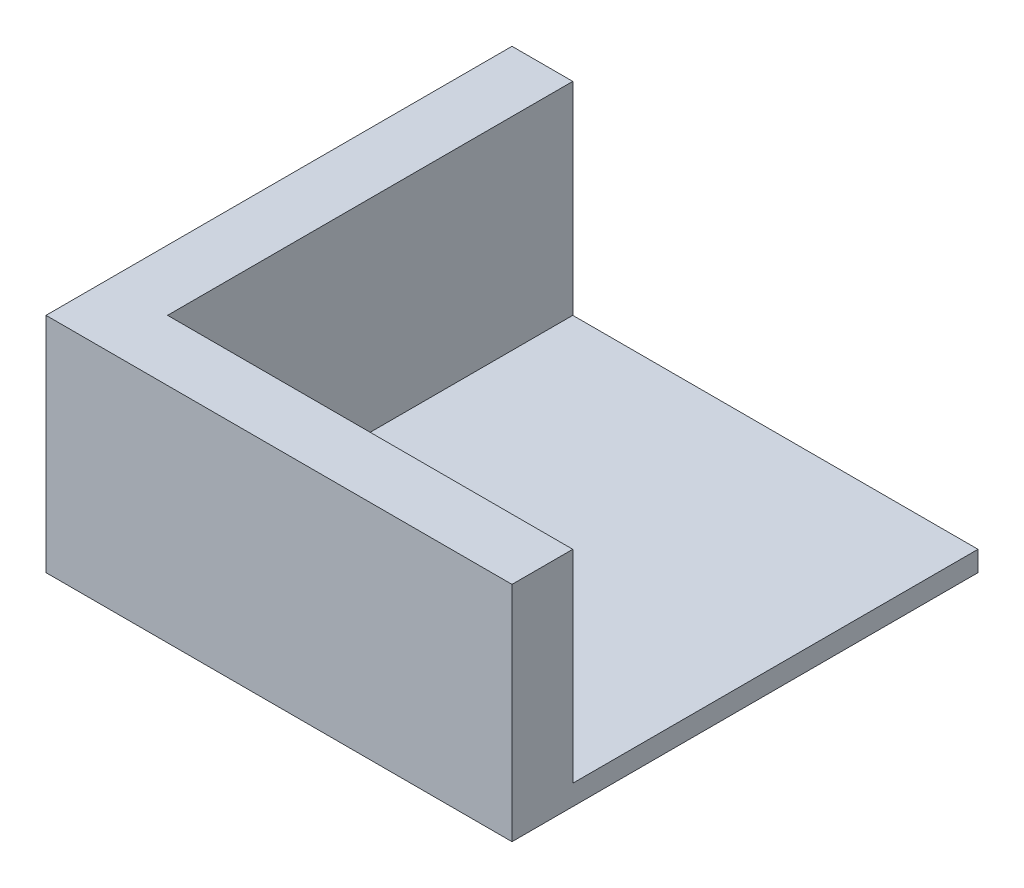
from build123d import *

# Parameters (mm, degrees)
BOSS_EXTRUDE1_DEPTH = 10
SKETCH2_W           = 23
SKETCH2_H           = 23
BOSS_EXTRUDE2_DEPTH = 1


with BuildPart() as part:
    # Sketch1 → Boss-Extrude1 (new body)
    with BuildSketch(Plane(origin=(0, 0, 0), x_dir=(1, 0, 0), z_dir=(0, 1, 0))):
        Polygon((-36.489872914, 17.750117647), (-36.489872914, -2.249882353), (-13.489872914, -2.249882353), (-13.489872914, 0.750117647), (-33.489872914, 0.750117647), (-33.489872914, 20.750117647), (-36.489872914, 20.750117647), align=None)
    extrude(amount=BOSS_EXTRUDE1_DEPTH)

    # Sketch2 → Boss-Extrude2 (add)
    with BuildSketch(Plane.XZ):
        with Locations((-24.989872914, -9.250117647)):
            Rectangle(SKETCH2_W, SKETCH2_H)
    extrude(amount=BOSS_EXTRUDE2_DEPTH)


solid = part.part
